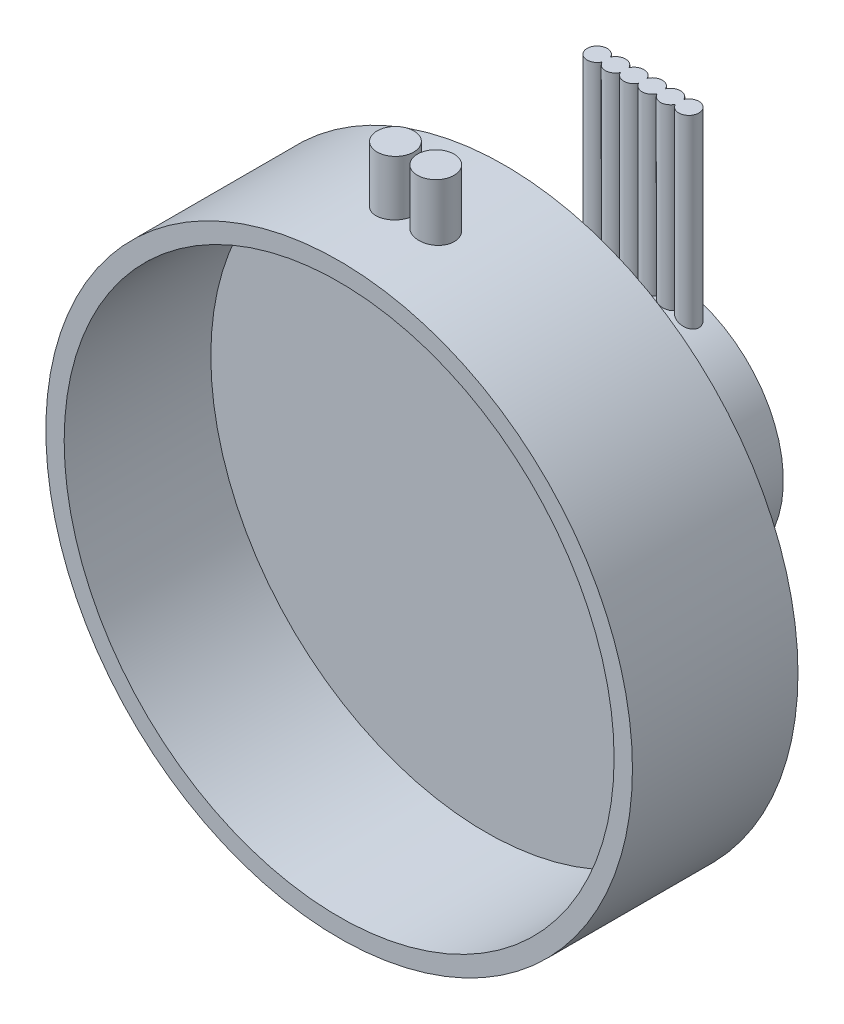
from build123d import *

# Parameters (mm, degrees)
ESQUISSE1_R             = 16
BOSS_EXTRU_1_DEPTH      = 9.03
ESQUISSE2_R             = 15
ENL_V_MAT_EXTRU_1_DEPTH = 8
ESQUISSE3_R             = 7.5
BOSS_EXTRU_2_DEPTH      = 5
ESQUISSE4_R             = 7
BOSS_EXTRU_3_DEPTH      = 1
ESQUISSE5_R             = 6.5
BOSS_EXTRU_4_DEPTH      = 2.7
BOSS_EXTRU_5_DEPTH      = 3
BOSS_EXTRU_5_DEPTH_BACK = 0.5
ESQUISSE6_R             = 1
BOSS_EXTRU_9_DEPTH      = 12


with BuildPart() as part:
    # Esquisse1 → Boss.-Extru.1 (new body)
    with BuildSketch(Plane.XY):
        Circle(ESQUISSE1_R)
    extrude(amount=BOSS_EXTRU_1_DEPTH)

    # Esquisse2 → Enlèv. mat.-Extru.1 (cut)
    with BuildSketch(Plane.XY.offset(9.03)):
        Circle(ESQUISSE2_R)
    extrude(amount=-ENL_V_MAT_EXTRU_1_DEPTH, mode=Mode.SUBTRACT)

    # Esquisse3 → Boss.-Extru.2 (add)
    with BuildSketch(Plane(origin=(0, 0, 0), x_dir=(-1, 0, 0), z_dir=(0, 0, -1))):
        with Locations(Location((0, 0, 0), (0, 0, 180))):
            Circle(ESQUISSE3_R)
    extrude(amount=BOSS_EXTRU_2_DEPTH)

    # Esquisse4 → Boss.-Extru.3 (add)
    with BuildSketch(Plane(origin=(0, 0, -5), x_dir=(-1, 0, 0), z_dir=(0, 0, -1))):
        Circle(ESQUISSE4_R)
    extrude(amount=BOSS_EXTRU_3_DEPTH)

    # Esquisse5 → Boss.-Extru.4 (add)
    with BuildSketch(Plane(origin=(0, 0, -6), x_dir=(-1, 0, 0), z_dir=(0, 0, -1))):
        with Locations(Location((0, 0, 0), (0, 0, 180))):
            Circle(ESQUISSE5_R)
    extrude(amount=BOSS_EXTRU_4_DEPTH)

    # Esquisse6 → Boss.-Extru.5 (add, two sides: drawn at the far end of the back side and taken through both)
    with BuildSketch(Plane(origin=(0, 16, 0), x_dir=(-1, 0, 0), z_dir=(0, 1, 0)).offset(-BOSS_EXTRU_5_DEPTH_BACK)):
        with Locations(Location((1.1, 4.857681609, 0), (0, 0, 90))):
            Circle(ESQUISSE6_R)
        with Locations(Location((-1.1, 4.857681609, 0), (0, 0, 90))):
            Circle(ESQUISSE6_R)
    extrude(amount=BOSS_EXTRU_5_DEPTH + BOSS_EXTRU_5_DEPTH_BACK)

    # Esquisse7 → Boss.-Extru.9 (add)
    with BuildSketch(Plane(origin=(0, 16, 0), x_dir=(-1, 0, 0), z_dir=(0, 1, 0))):
        with BuildLine():
            ThreePointArc((2.218175405, -7.992904998), (3.268175405, -7.763776214), (2.218175405, -7.534647429))
            ThreePointArc((2.218175405, -7.534647429), (1.718175405, -7.213776214), (1.218175405, -7.534647429))
            ThreePointArc((1.218175405, -7.534647429), (0.718175405, -7.213776214), (0.218175405, -7.534647429))
            ThreePointArc((0.218175405, -7.534647429), (-0.281824595, -7.213776214), (-0.781824595, -7.534647429))
            ThreePointArc((-0.781824595, -7.534647429), (-1.281824595, -7.213776214), (-1.781824595, -7.534647429))
            ThreePointArc((-1.781824595, -7.534647429), (-2.831824595, -7.763776214), (-1.781824595, -7.992904998))
            ThreePointArc((-1.781824595, -7.992904998), (-1.281824595, -8.313776214), (-0.781824595, -7.992904998))
            ThreePointArc((-0.781824595, -7.992904998), (-0.281824595, -8.313776214), (0.218175405, -7.992904998))
            ThreePointArc((0.218175405, -7.992904998), (0.718175405, -8.313776214), (1.218175405, -7.992904998))
            ThreePointArc((1.218175405, -7.992904998), (1.718175405, -8.313776214), (2.218175405, -7.992904998))
        make_face()
    extrude(amount=-BOSS_EXTRU_9_DEPTH)


solid = part.part
